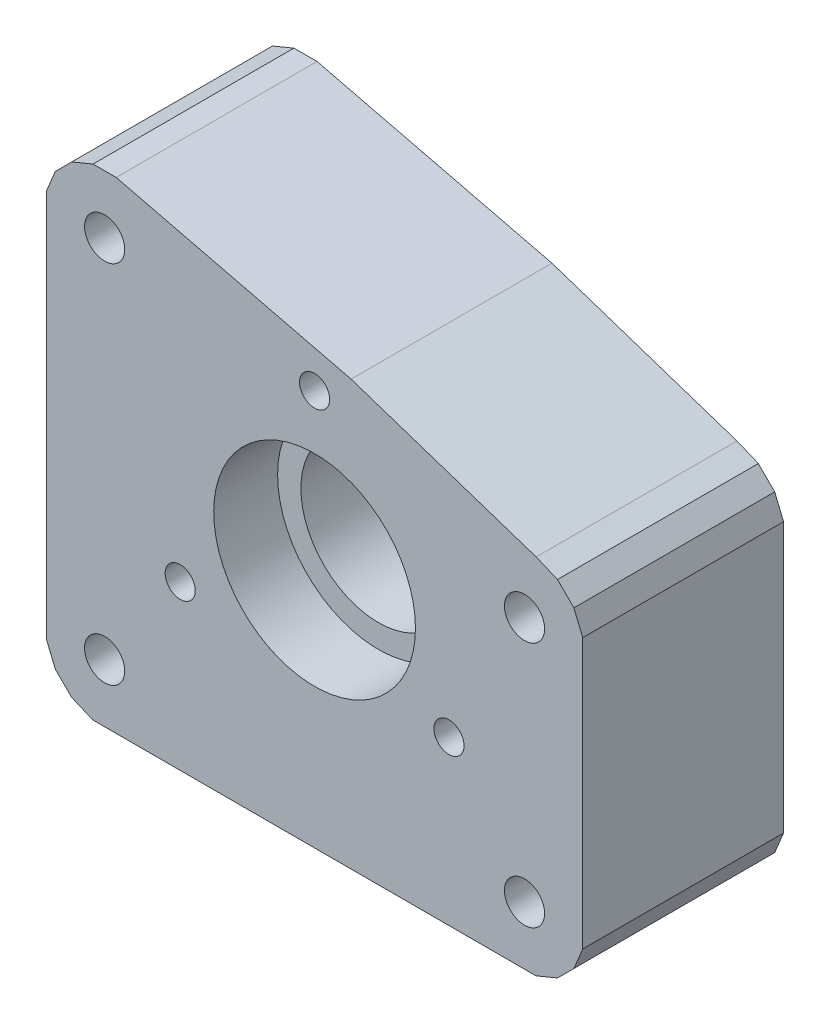
from build123d import *

# Parameters (mm, degrees)
CARTRIDGE_BODY_START    = 34
PROFILE_1_R             = 8.5
PROFILE_1_R_2           = 2.2
PROFILE_1_R_3           = 1.65
CARTRIDGE_BODY_DEPTH    = 22
INBOARD_608_SEAT_START  = 33.99
PROFILE_2_R             = 11.05
INBOARD_608_SEAT_DEPTH  = 7.01
OUTBOARD_608_SEAT_START = 49
PROFILE_3_R             = 11.05
OUTBOARD_608_SEAT_DEPTH = 7.01


with BuildPart() as part:
    # Profile_1 → Cartridge_body (new body)
    with BuildSketch(Plane.XY.offset(CARTRIDGE_BODY_START)):
        Polygon((26.611206515, -25.40455248), (28.40455248, -23.611206515), (29.375104323, -21.268087093), (29.375104323, 8.268087093), (28.40455248, 10.611206515), (26.611206515, 12.40455248), (24.268087093, 13.375104323), (3.999351601, 20.106098248), (-21.731912907, 26.375104323), (-24.268087093, 26.375104323), (-26.611206515, 25.40455248), (-28.40455248, 23.611206515), (-29.375104323, 21.268087093), (-29.375104323, -21.268087093), (-28.40455248, -23.611206515), (-26.611206515, -25.40455248), (-24.268087093, -26.375104323), (24.268087093, -26.375104323), align=None)
        Circle(PROFILE_1_R, mode=Mode.SUBTRACT)
        with Locations((23, -20)):
            Circle(PROFILE_1_R_2, mode=Mode.SUBTRACT)
        with Locations((-23, -20)):
            Circle(PROFILE_1_R_2, mode=Mode.SUBTRACT)
        with Locations((23, 7)):
            Circle(PROFILE_1_R_2, mode=Mode.SUBTRACT)
        with Locations((-23, 20)):
            Circle(PROFILE_1_R_2, mode=Mode.SUBTRACT)
        with Locations((0, 17)):
            Circle(PROFILE_1_R_3, mode=Mode.SUBTRACT)
        with Locations((14.722431864, -8.5)):
            Circle(PROFILE_1_R_3, mode=Mode.SUBTRACT)
        with Locations((-14.722431864, -8.5)):
            Circle(PROFILE_1_R_3, mode=Mode.SUBTRACT)
    extrude(amount=CARTRIDGE_BODY_DEPTH)

    # Profile_2 → Inboard_608_seat (cut)
    with BuildSketch(Plane.XY.offset(INBOARD_608_SEAT_START)):
        Circle(PROFILE_2_R)
    extrude(amount=INBOARD_608_SEAT_DEPTH, mode=Mode.SUBTRACT)

    # Profile_3 → Outboard_608_seat (cut)
    with BuildSketch(Plane.XY.offset(OUTBOARD_608_SEAT_START)):
        Circle(PROFILE_3_R)
    extrude(amount=OUTBOARD_608_SEAT_DEPTH, mode=Mode.SUBTRACT)


solid = part.part
